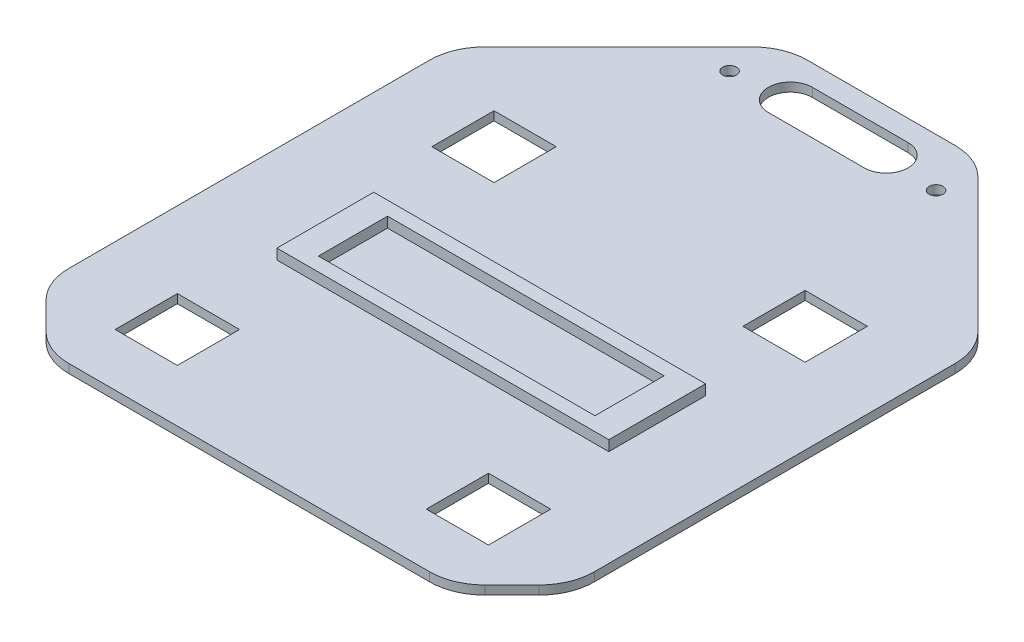
from build123d import *

# Parameters (mm, degrees)
BODY_DEPTH                         = 6.35
HANDLE_DEPTH                       = 6.35
SKETCH3_R                          = 10
BEARING_RINGS_DEPTH                = 3.175
SKETCH7_W                          = 239.992041534
SKETCH7_H                          = 70
OUTSIDE_PERIMETER_CONSTRAINT_DEPTH = 7.5
SKETCH10_W                         = 200
SKETCH10_H                         = 50
INSIDE_PERIMETER_CONSTRAINT_DEPTH  = 7.5
SKETCH11_R                         = 5
LOCKING_MECHANISM_HOLES_DEPTH      = 6.36
SKETCH12_W                         = 45
SKETCH12_H                         = 45
SQUARE_BEARING_CUT_DEPTH           = 6.35
FILLET1_R                          = 40
FILLET2_R                          = 40


with BuildPart() as part:
    # Sketch1 → Body (new body)
    with BuildSketch(Plane(origin=(0, 0, 0), x_dir=(1, 0, 0), z_dir=(0, 1, 0))):
        Polygon((0, 0), (294, 0), (336.996020767, 43.003978862), (336.996020767, 337.003978862), (217, 456.999999629), (77, 456.999999629), (-42.996020767, 337.003978862), (-42.996020767, 43.003978862), align=None)
    extrude(amount=BODY_DEPTH)

    # Sketch2 → Handle (cut)
    with BuildSketch(Plane(origin=(0, 6.35, 0), x_dir=(1, 0, 0), z_dir=(0, 1, 0))):
        with BuildLine():
            Line((112.35, 441.799999629), (181.65, 441.799999629))
            ThreePointArc((181.65, 441.799999629), (197.5, 425.949999629), (181.65, 410.099999629))
            Line((181.65, 410.099999629), (112.35, 410.099999629))
            ThreePointArc((112.35, 410.099999629), (96.5, 425.949999629), (112.35, 441.799999629))
        make_face()
    extrude(amount=-HANDLE_DEPTH, mode=Mode.SUBTRACT)

    # Sketch3 → Bearing Rings (cut)
    with BuildSketch(Plane(origin=(0, 6.35, 0), x_dir=(1, 0, 0), z_dir=(0, 1, 0))):
        with Locations(Location((27.003979233, 300, 0), (0, 0, 270))):
            Circle(SKETCH3_R)
        with Locations(Location((266.996020767, 300, 0), (0, 0, 270))):
            Circle(SKETCH3_R)
        with Locations(Location((266.996020767, 50, 0), (0, 0, 270))):
            Circle(SKETCH3_R)
        with Locations(Location((27.003979233, 50, 0), (0, 0, 270))):
            Circle(SKETCH3_R)
    extrude(amount=-BEARING_RINGS_DEPTH, mode=Mode.SUBTRACT)

    # Sketch7 → Outside Perimeter Constraint (add)
    with BuildSketch(Plane(origin=(0, 6.35, 0), x_dir=(1, 0, 0), z_dir=(0, 1, 0))):
        with Locations((147, 175)):
            Rectangle(SKETCH7_W, SKETCH7_H)
    extrude(amount=OUTSIDE_PERIMETER_CONSTRAINT_DEPTH)

    # Sketch10 → Inside Perimeter Constraint (cut)
    with BuildSketch(Plane(origin=(0, 13.85, 0), x_dir=(1, 0, 0), z_dir=(0, 1, 0))):
        with Locations((147, 175)):
            Rectangle(SKETCH10_W, SKETCH10_H)
    extrude(amount=-INSIDE_PERIMETER_CONSTRAINT_DEPTH, mode=Mode.SUBTRACT)

    # Sketch11 → Locking Mechanism Holes (cut)
    with BuildSketch(Plane(origin=(0, 6.35, 0), x_dir=(1, 0, 0), z_dir=(0, 1, 0))):
        with Locations(Location((221.65, 421.999999629, 0), (0, 0, 270))):
            Circle(SKETCH11_R)
        with Locations(Location((72.35, 421.999999629, 0), (0, 0, 270))):
            Circle(SKETCH11_R)
    extrude(amount=-LOCKING_MECHANISM_HOLES_DEPTH, mode=Mode.SUBTRACT)

    # Sketch12 → Square Bearing Cut (cut)
    with BuildSketch(Plane(origin=(0, 6.35, 0), x_dir=(1, 0, 0), z_dir=(0, 1, 0))):
        with Locations((34.503979233, 289.499999629)):
            Rectangle(SKETCH12_W, SKETCH12_H)
        with Locations((259.496020767, 289.499999629)):
            Rectangle(SKETCH12_W, SKETCH12_H)
        with Locations((259.496020767, 60.500000371)):
            Rectangle(SKETCH12_W, SKETCH12_H)
        with Locations((34.503979233, 60.500000371)):
            Rectangle(SKETCH12_W, SKETCH12_H)
    extrude(amount=-SQUARE_BEARING_CUT_DEPTH, mode=Mode.SUBTRACT)

    # Fillet1
    fillet1_edges = [part.edges().sort_by_distance(p)[0] for p in [
        (77, 3.175, -456.999999629),
        (217, 3.175, -456.999999629),
    ]]
    fillet(fillet1_edges, radius=FILLET1_R)

    # Fillet2
    fillet2_edges = [part.edges().sort_by_distance(p)[0] for p in [
        (-42.996020767, 3.175, -43.003978862),
        (-42.996020767, 3.175, -337.003978862),
        (336.996020767, 3.175, -337.003978862),
        (336.996020767, 3.175, -43.003978862),
        (294, 3.175, 0),
        (0, 3.175, 0),
    ]]
    fillet(fillet2_edges, radius=FILLET2_R)


solid = part.part
